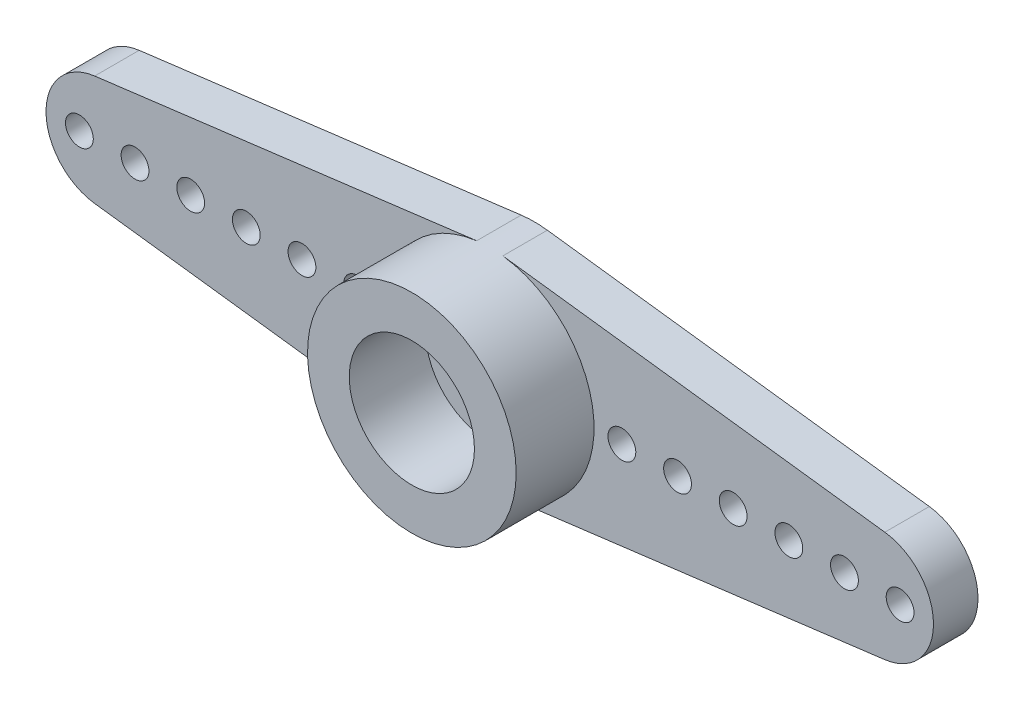
from build123d import *

# Parameters (mm, degrees)
SKETCH1_R             = 0.5
BOSS_EXTRUDE1_DEPTH   = 1.6
BOSS_EXTRUDE1_2_DEPTH = 1.6
SKETCH1_4_R           = 3.75
SKETCH1_4_R_2         = 1.2
BOSS_EXTRUDE2_DEPTH   = 4.4
SKETCH2_R             = 2.25
CUT_EXTRUDE1_DEPTH    = 2.75


with BuildPart() as part:
    # Sketch1 → Boss-Extrude1 (new body)
    with BuildSketch(Plane.XY):
        with BuildLine():
            ThreePointArc((0.470430108, 3.720375722), (3.75, 0), (0.470430108, -3.720375722))
            Line((0.470430108, -3.720375722), (14.200896057, -1.984200385))
            ThreePointArc((14.200896057, -1.984200385), (15.95, 0), (14.200896057, 1.984200385))
            Line((14.200896057, 1.984200385), (0.470430108, 3.720375722))
        make_face()
        with Locations((14.75, 0)):
            Circle(SKETCH1_R, mode=Mode.SUBTRACT)
        with Locations((12.75, 0)):
            Circle(SKETCH1_R, mode=Mode.SUBTRACT)
        with Locations((10.75, 0)):
            Circle(SKETCH1_R, mode=Mode.SUBTRACT)
        with Locations((8.75, 0)):
            Circle(SKETCH1_R, mode=Mode.SUBTRACT)
        with Locations((6.75, 0)):
            Circle(SKETCH1_R, mode=Mode.SUBTRACT)
        with Locations((4.75, 0)):
            Circle(SKETCH1_R, mode=Mode.SUBTRACT)
    extrude(amount=BOSS_EXTRUDE1_DEPTH)



with BuildPart() as body_2:
    # Sketch1 → Boss-Extrude1 2 (new body)
    with BuildSketch(Plane.XY):
        with BuildLine():
            ThreePointArc((-0.470430108, -3.720375722), (-3.75, 0), (-0.470430108, 3.720375722))
            Line((-0.470430108, 3.720375722), (-14.200896057, 1.984200385))
            ThreePointArc((-14.200896057, 1.984200385), (-15.95, 0), (-14.200896057, -1.984200385))
            Line((-14.200896057, -1.984200385), (-0.470430108, -3.720375722))
        make_face()
        with Locations((-14.75, 0)):
            Circle(SKETCH1_R, mode=Mode.SUBTRACT)
        with Locations((-12.75, 0)):
            Circle(SKETCH1_R, mode=Mode.SUBTRACT)
        with Locations((-10.75, 0)):
            Circle(SKETCH1_R, mode=Mode.SUBTRACT)
        with Locations((-8.75, 0)):
            Circle(SKETCH1_R, mode=Mode.SUBTRACT)
        with Locations((-6.75, 0)):
            Circle(SKETCH1_R, mode=Mode.SUBTRACT)
        with Locations((-4.75, 0)):
            Circle(SKETCH1_R, mode=Mode.SUBTRACT)
    extrude(amount=BOSS_EXTRUDE1_2_DEPTH)


with BuildPart() as part_1:
    add(part.part)

    add(body_2.part)  # Boss-Extrude2 merges body 2
    # Sketch1<4> → Boss-Extrude2 (add)
    with BuildSketch(Plane.XY):
        Circle(SKETCH1_4_R)
        Circle(SKETCH1_4_R_2, mode=Mode.SUBTRACT)
    extrude(amount=BOSS_EXTRUDE2_DEPTH)

    # Sketch2 → Cut-Extrude1 (cut)
    with BuildSketch(Plane.XY.offset(4.4)):
        Circle(SKETCH2_R)
    extrude(amount=-CUT_EXTRUDE1_DEPTH, mode=Mode.SUBTRACT)


solid = part_1.part
